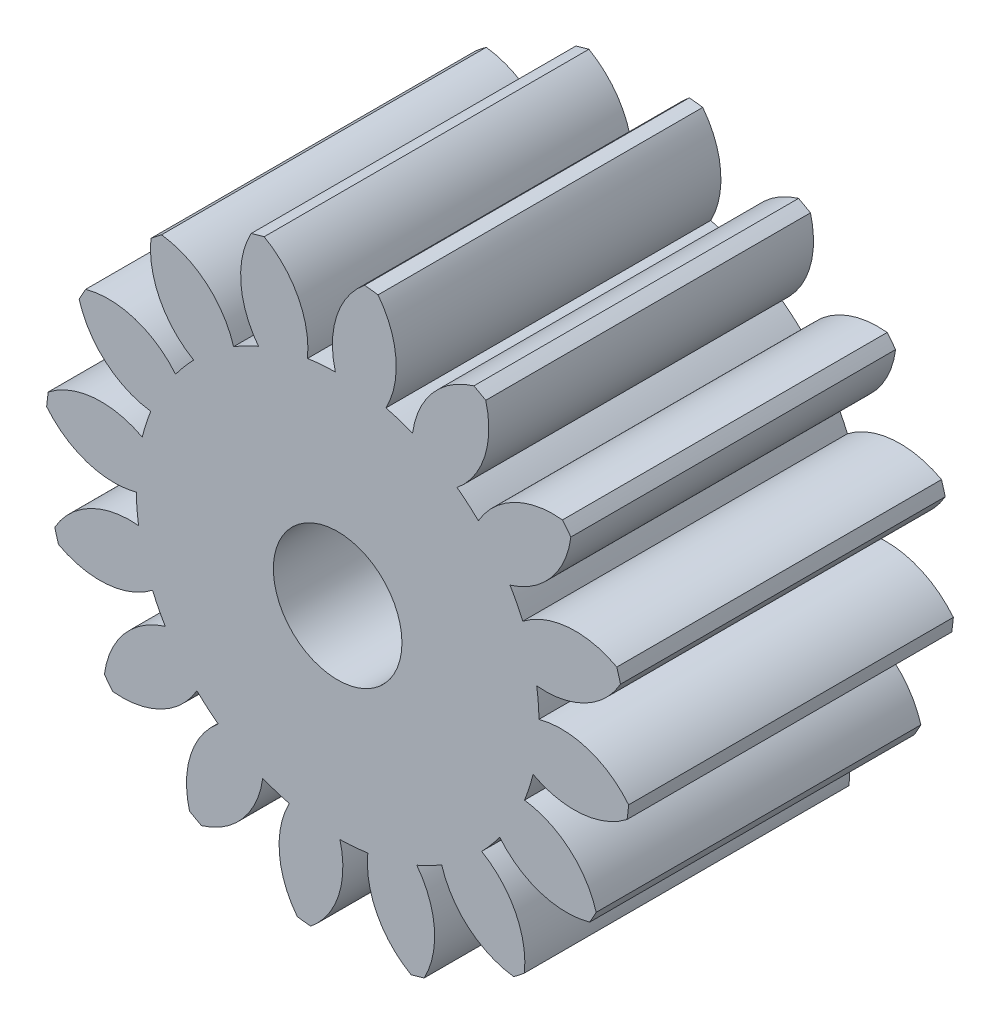
from build123d import *

# Parameters (mm, degrees)
CROQUIS1_R              = 4.5
CROQUIS1_R_2            = 0.99
SALIENTE_EXTRUIR1_DEPTH = 5
CORTAR_EXTRUIR1_START   = -5
CORTAR_EXTRUIR1_DEPTH   = 5
MATRIZC1_COUNT          = 16


with BuildPart() as part:
    # Croquis1 → Saliente-Extruir1 (new body)
    with BuildSketch(Plane.XY):
        Circle(CROQUIS1_R)
        Circle(CROQUIS1_R_2, mode=Mode.SUBTRACT)
    extrude(amount=SALIENTE_EXTRUIR1_DEPTH)

    # Croquis2 → Cortar-Extruir1 (cut)
    with BuildSketch(Plane.XY.offset(5).offset(CORTAR_EXTRUIR1_START)):
        with BuildLine():
            ThreePointArc((0.414565113, 4.480863284), (-0.363605747, 4.48528604), (-1.130903099, 4.355577824))
            ThreePointArc((-1.130903099, 4.355577824), (-0.606600737, 3.808965656), (-0.464433785, 3.06501244))
            ThreePointArc((-0.464433785, 3.06501244), (-0.250483959, 3.089863716), (-0.035324926, 3.099798727))
            ThreePointArc((-0.035324926, 3.099798727), (-0.014845978, 3.856937051), (0.414565113, 4.480863284))
        make_face()
    cortar_extruir1 = extrude(amount=CORTAR_EXTRUIR1_DEPTH, mode=Mode.SUBTRACT)

    # MatrizC1: Cortar-Extruir1 ×16 about axis
    matrizc1_axis = Axis((0, 0, 0), (0, 0, 1))
    for i in range(1, MATRIZC1_COUNT):
        add(cortar_extruir1.rotate(matrizc1_axis, i * 360 / MATRIZC1_COUNT), mode=Mode.SUBTRACT)


solid = part.part
